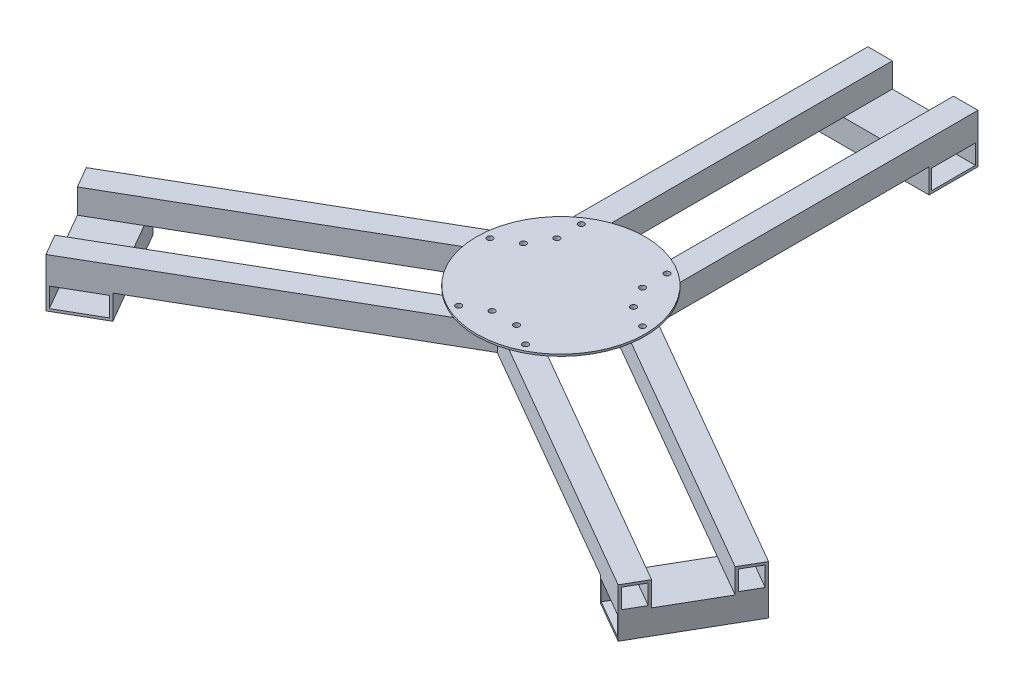
from build123d import *

# Parameters (mm, degrees)
SKETCH6_W             = 25.4
SKETCH6_H             = 25.4
SKETCH6_W_2           = 20.32
SKETCH6_H_2           = 20.32
BOSS_EXTRUDE3_DEPTH   = 363.22
BOSS_EXTRUDE3_2_DEPTH = 363.22
SKETCH7_W             = 50.8
SKETCH7_H             = 25.359897542
SKETCH7_W_2           = 45.72
SKETCH7_H_2           = 20.279897542
BOSS_EXTRUDE4_DEPTH   = 114.3
CUT_EXTRUDE1_DEPTH    = 384.612481677
CUT_EXTRUDE2_DEPTH    = 384.612481677
CIRPATTERN1_COUNT     = 3
SKETCH12_R            = 3
CUT_EXTRUDE3_DEPTH    = 519.942549655
SKETCH13_R            = 87.5
BOSS_EXTRUDE6_DEPTH   = 2
SKETCH14_R            = 3
CUT_EXTRUDE4_DEPTH    = 518.180396616


with BuildPart() as part:
    # Sketch6 → Boss-Extrude3 (new body)
    with BuildSketch(Plane.XY.offset(-12.7)):
        with Locations((-44.45, 0)):
            Rectangle(SKETCH6_W, SKETCH6_H)
        with Locations((-44.45, 0)):
            Rectangle(SKETCH6_W_2, SKETCH6_H_2, mode=Mode.SUBTRACT)
    extrude(amount=-BOSS_EXTRUDE3_DEPTH)



with BuildPart() as body_2:
    # Sketch6 → Boss-Extrude3 2 (new body)
    with BuildSketch(Plane.XY.offset(-12.7)):
        with Locations((44.45, 0)):
            Rectangle(SKETCH6_W, SKETCH6_H)
        with Locations((44.45, 0)):
            Rectangle(SKETCH6_W_2, SKETCH6_H_2, mode=Mode.SUBTRACT)
    extrude(amount=-BOSS_EXTRUDE3_2_DEPTH)


with BuildPart() as part_1:
    add(part.part)

    add(body_2.part)  # Boss-Extrude4 merges body 2
    # Sketch7 → Boss-Extrude4 (add)
    with BuildSketch(Plane(origin=(-57.15, 0, 0), x_dir=(0, 0, -1), z_dir=(1, 0, 0))):
        with Locations((350.52, -25.379948771)):
            Rectangle(SKETCH7_W, SKETCH7_H)
        with Locations((350.52, -25.379948771)):
            Rectangle(SKETCH7_W_2, SKETCH7_H_2, mode=Mode.SUBTRACT)
    extrude(amount=BOSS_EXTRUDE4_DEPTH)

    # Sketch9 → Cut-Extrude1 (cut, through all)
    with BuildSketch(Plane(origin=(0, 12.7, 0), x_dir=(1, 0, 0), z_dir=(0, 1, 0))):
        Polygon((0, 0), (66.166370432, 38.20117178), (56.531711502, -13.195312554), align=None)
    extrude(amount=-CUT_EXTRUDE1_DEPTH, mode=Mode.SUBTRACT)

    # Sketch10 → Cut-Extrude2 (cut, through all)
    with BuildSketch(Plane(origin=(0, 12.7, 0), x_dir=(1, 0, 0), z_dir=(0, 1, 0))):
        Polygon((0, 0), (-91.357136084, 52.74506711), (-72.051101597, -19.306034487), align=None)
    extrude(amount=-CUT_EXTRUDE2_DEPTH, mode=Mode.SUBTRACT)


with BuildPart() as cirpattern1_1:
    # CirPattern1: pattern copy
    add(part_1.part.rotate(Axis((0, 0, 0), (0, 1, 0)), 1 * 360 / CIRPATTERN1_COUNT))


with BuildPart() as cirpattern1_2:
    # CirPattern1: pattern copy
    add(part_1.part.rotate(Axis((0, 0, 0), (0, 1, 0)), 2 * 360 / CIRPATTERN1_COUNT))


with BuildPart() as cut_extrude3_tool:
    # Sketch12 → Cut-Extrude3 (new, through all)
    with BuildSketch(Plane(origin=(0, 12.7, 0), x_dir=(1, 0, 0), z_dir=(0, 1, 0))):
        with Locations(Location((44.45, 40.327916303, 0), (0, 0, 90))):
            Circle(SKETCH12_R)
        with Locations(Location((57.15, 18.330871047, 0), (0, 0, 90))):
            Circle(SKETCH12_R)
    extrude(amount=-CUT_EXTRUDE3_DEPTH)


with BuildPart() as part_2:
    add(part_1.part)

    # Cut-Extrude3: cut by cut_extrude3_tool
    add(cut_extrude3_tool.part, mode=Mode.SUBTRACT)


    add(cirpattern1_1.part)  # Boss-Extrude6 merges CirPattern1_1


with BuildPart() as cirpattern1_2_1:
    add(cirpattern1_2.part)

    # Cut-Extrude3: cut by cut_extrude3_tool
    add(cut_extrude3_tool.part, mode=Mode.SUBTRACT)


with BuildPart() as part_3:
    add(part_2.part)

    add(cirpattern1_2_1.part)  # Boss-Extrude6 merges CirPattern1_2
    # Sketch13 → Boss-Extrude6 (add)
    with BuildSketch(Plane(origin=(0, 12.7, 0), x_dir=(1, 0, 0), z_dir=(0, 1, 0))):
        with Locations(Location((0, 0, 0), (0, 0, 68.724233024))):
            Circle(SKETCH13_R)
    extrude(amount=BOSS_EXTRUDE6_DEPTH)

    # Sketch14 → Cut-Extrude4 (cut, through all)
    with BuildSketch(Plane.XZ.offset(12.7)):
        with Locations(Location((57.15, -18.330871047, 0), (0, 0, 270))):
            Circle(SKETCH14_R)
        with Locations(Location((44.45, -40.327916303, 0), (0, 0, 270))):
            Circle(SKETCH14_R)
        with Locations(Location((-57.15, -18.330871047, 0), (0, 0, 270))):
            Circle(SKETCH14_R)
        with Locations(Location((-44.45, -40.327916303, 0), (0, 0, 270))):
            Circle(SKETCH14_R)
        with Locations(Location((12.7, 58.65878735, 0), (0, 0, 270))):
            Circle(SKETCH14_R)
        with Locations(Location((-12.7, 58.65878735, 0), (0, 0, 270))):
            Circle(SKETCH14_R)
        with Locations(Location((44.45, -65.727916303, 0), (0, 0, 270))):
            Circle(SKETCH14_R)
        with Locations(Location((79.147045256, -5.630871047, 0), (0, 0, 270))):
            Circle(SKETCH14_R)
        with Locations(Location((34.697045256, 71.35878735, 0), (0, 0, 270))):
            Circle(SKETCH14_R)
        with Locations(Location((-34.697045256, 71.35878735, 0), (0, 0, 270))):
            Circle(SKETCH14_R)
        with Locations(Location((-79.147045256, -5.630871047, 0), (0, 0, 270))):
            Circle(SKETCH14_R)
        with Locations(Location((-44.45, -65.727916303, 0), (0, 0, 270))):
            Circle(SKETCH14_R)
    extrude(amount=-CUT_EXTRUDE4_DEPTH, mode=Mode.SUBTRACT)


solid = part_3.part
